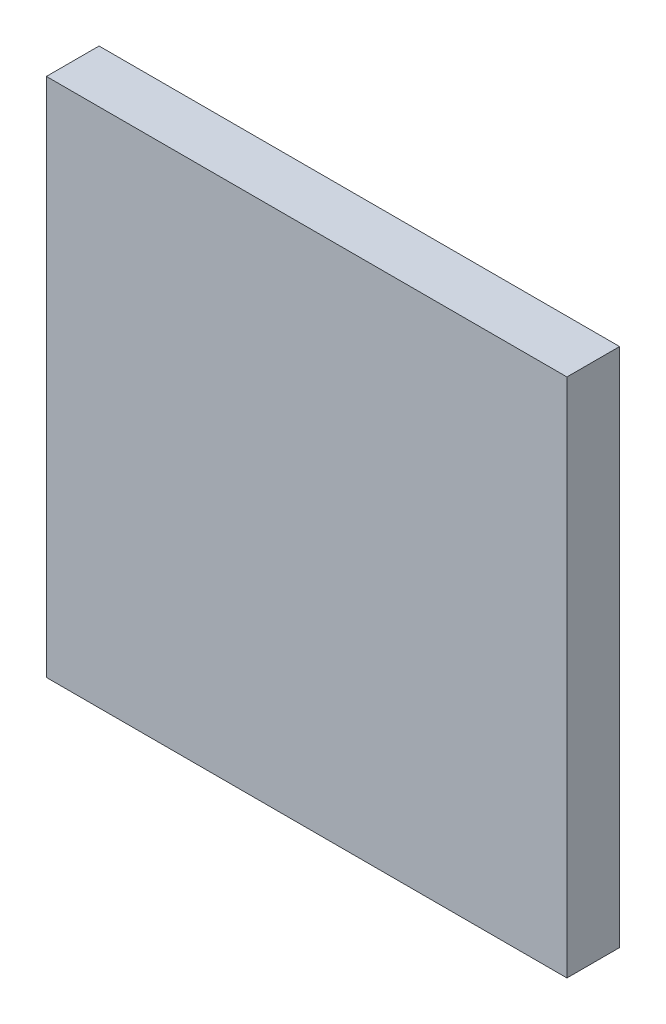
from build123d import *

# Parameters (mm, degrees)
SKETCH1_W           = 107.95
SKETCH1_H           = 107.95
BOSS_EXTRUDE1_DEPTH = 5.461


with BuildPart() as part:
    # Sketch1 → Boss-Extrude1 (new, symmetric)
    with BuildSketch(Plane.XY):
        Rectangle(SKETCH1_W, SKETCH1_H)
    extrude(amount=BOSS_EXTRUDE1_DEPTH, both=True)


solid = part.part
